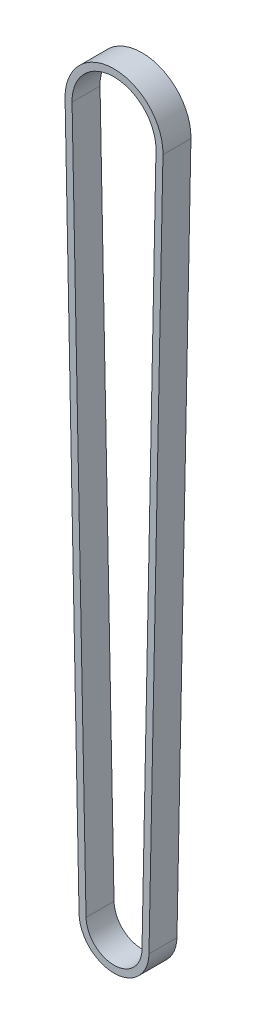
from build123d import *

# Parameters (mm, degrees)
BOSS_EXTRUDE1_DEPTH = 16


with BuildPart() as part:
    # Sketch1 → Boss-Extrude1 (new body)
    with BuildSketch(Plane.XY):
        with BuildLine():
            Line((-19.9959996, -0.4), (-27.99439944, 399.44))
            ThreePointArc((-27.99439944, 399.44), (0, 428), (27.99439944, 399.44))
            Line((27.99439944, 399.44), (19.9959996, -0.4))
            ThreePointArc((19.9959996, -0.4), (0, -20), (-19.9959996, -0.4))
        make_face()
        with BuildLine():
            Line((-15.99679968, -0.32), (-23.99519952, 399.52))
            ThreePointArc((-23.99519952, 399.52), (0, 424), (23.99519952, 399.52))
            Line((23.99519952, 399.52), (15.99679968, -0.32))
            ThreePointArc((15.99679968, -0.32), (0, -16), (-15.99679968, -0.32))
        make_face(mode=Mode.SUBTRACT)
    extrude(amount=BOSS_EXTRUDE1_DEPTH)


solid = part.part
